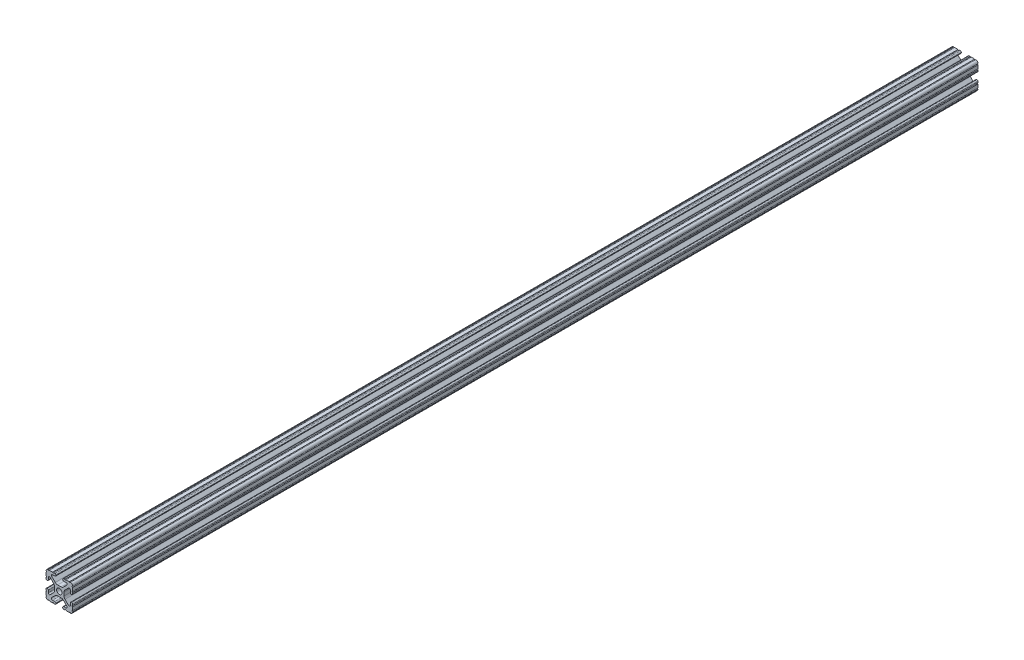
from build123d import *

# Parameters (mm, degrees)
SKETCH1_R           = 2.6035
BOSS_EXTRUDE1_DEPTH = 431.8


with BuildPart() as part:
    # Sketch1 → Boss-Extrude1 (new, symmetric)
    with BuildSketch(Plane.XY):
        with BuildLine():
            Line((-7.179650497, -8.645192506), (-3.952270251, -5.423690499))
            ThreePointArc((-3.952270251, -5.423690499), (-2.922936451, -4.736929036), (-1.709253557, -4.4958))
            Line((-1.709253557, -4.4958), (1.709253557, -4.4958))
            ThreePointArc((1.709253557, -4.4958), (2.922936451, -4.736929036), (3.952270251, -5.423690499))
            Line((3.952270251, -5.423690499), (7.179650497, -8.645192506))
            ThreePointArc((7.179650497, -8.645192506), (7.41473083, -9.822813117), (6.416408329, -10.4902))
            Line((6.416408329, -10.4902), (4.287512407, -10.4902))
            ThreePointArc((4.287512407, -10.4902), (3.54574862, -10.79744862), (3.2385, -11.539212407))
            Line((3.2385, -11.539212407), (3.2385, -11.650987593))
            ThreePointArc((3.2385, -11.650987593), (3.54574862, -12.39275138), (4.287512407, -12.7))
            Line((4.287512407, -12.7), (5.317126718, -12.7))
            ThreePointArc((5.317126718, -12.7), (5.825126718, -12.192), (6.333126718, -12.7))
            Line((6.333126718, -12.7), (9.550443118, -12.7))
            ThreePointArc((9.550443118, -12.7), (10.058366869, -12.192000006), (10.566443095, -12.699847501))
            ThreePointArc((10.566443095, -12.699847501), (12.082537762, -12.08250727), (12.699846982, -10.566399977))
            ThreePointArc((12.699846982, -10.566399977), (12.192000006, -10.058323491), (12.7, -9.5504))
            Line((12.7, -9.5504), (12.7, -6.3330836))
            ThreePointArc((12.7, -6.3330836), (12.192, -5.8250836), (12.7, -5.3170836))
            Line((12.7, -5.3170836), (12.7, -4.287469289))
            ThreePointArc((12.7, -4.287469289), (12.39275138, -3.545705502), (11.650987593, -3.238456882))
            Line((11.650987593, -3.238456882), (11.539212407, -3.238456882))
            ThreePointArc((11.539212407, -3.238456882), (10.79744862, -3.545705502), (10.4902, -4.287469289))
            Line((10.4902, -4.287469289), (10.4902, -6.402089023))
            ThreePointArc((10.4902, -6.402089023), (9.856505071, -7.351067942), (8.737131347, -7.129408934))
            Line((8.737131347, -7.129408934), (5.441005833, -3.840816462))
            ThreePointArc((5.441005833, -3.840816462), (4.750877967, -2.809883091), (4.5085, -1.593185507))
            Line((4.5085, -1.593185507), (4.5085, 1.593185507))
            ThreePointArc((4.5085, 1.593185507), (4.750877967, 2.809883091), (5.441005833, 3.840816462))
            Line((5.441005833, 3.840816462), (8.737131347, 7.129408934))
            ThreePointArc((8.737131347, 7.129408934), (9.856505071, 7.351067942), (10.4902, 6.402089023))
            Line((10.4902, 6.402089023), (10.4902, 4.287469289))
            ThreePointArc((10.4902, 4.287469289), (10.79744862, 3.545705502), (11.539212407, 3.238456882))
            Line((11.539212407, 3.238456882), (11.650987593, 3.238456882))
            ThreePointArc((11.650987593, 3.238456882), (12.39275138, 3.545705502), (12.7, 4.287469289))
            Line((12.7, 4.287469289), (12.7, 5.3170836))
            ThreePointArc((12.7, 5.3170836), (12.192, 5.8250836), (12.7, 6.3330836))
            Line((12.7, 6.3330836), (12.7, 9.5504))
            ThreePointArc((12.7, 9.5504), (12.192000006, 10.058323491), (12.699846982, 10.566399977))
            ThreePointArc((12.699846982, 10.566399977), (12.082537762, 12.08250727), (10.566443095, 12.699847501))
            ThreePointArc((10.566443095, 12.699847501), (10.058366869, 12.192000006), (9.550443118, 12.7))
            Line((9.550443118, 12.7), (6.333126718, 12.7))
            ThreePointArc((6.333126718, 12.7), (5.825126718, 12.192), (5.317126718, 12.7))
            Line((5.317126718, 12.7), (4.287512407, 12.7))
            ThreePointArc((4.287512407, 12.7), (3.54574862, 12.39275138), (3.2385, 11.650987593))
            Line((3.2385, 11.650987593), (3.2385, 11.539212407))
            ThreePointArc((3.2385, 11.539212407), (3.54574862, 10.79744862), (4.287512407, 10.4902))
            Line((4.287512407, 10.4902), (6.476788598, 10.4902))
            ThreePointArc((6.476788598, 10.4902), (7.432222385, 9.85140422), (7.207036008, 8.724370562))
            Line((7.207036008, 8.724370562), (3.898272566, 5.423169045))
            ThreePointArc((3.898272566, 5.423169045), (2.869120213, 4.736787962), (1.655778399, 4.4958))
            Line((1.655778399, 4.4958), (-1.655778399, 4.4958))
            ThreePointArc((-1.655778399, 4.4958), (-2.869120213, 4.736787962), (-3.898272566, 5.423169045))
            Line((-3.898272566, 5.423169045), (-7.207036008, 8.724370562))
            ThreePointArc((-7.207036008, 8.724370562), (-7.432222385, 9.85140422), (-6.476788598, 10.4902))
            Line((-6.476788598, 10.4902), (-4.287512407, 10.4902))
            ThreePointArc((-4.287512407, 10.4902), (-3.54574862, 10.79744862), (-3.2385, 11.539212407))
            Line((-3.2385, 11.539212407), (-3.2385, 11.650987593))
            ThreePointArc((-3.2385, 11.650987593), (-3.54574862, 12.39275138), (-4.287512407, 12.7))
            Line((-4.287512407, 12.7), (-5.317126718, 12.7))
            ThreePointArc((-5.317126718, 12.7), (-5.825126718, 12.192), (-6.333126718, 12.7))
            Line((-6.333126718, 12.7), (-9.550443118, 12.7))
            ThreePointArc((-9.550443118, 12.7), (-10.058366869, 12.192000006), (-10.566443095, 12.699847501))
            ThreePointArc((-10.566443095, 12.699847501), (-12.082537762, 12.08250727), (-12.699846982, 10.566399977))
            ThreePointArc((-12.699846982, 10.566399977), (-12.192000006, 10.058323491), (-12.7, 9.5504))
            Line((-12.7, 9.5504), (-12.7, 6.3330836))
            ThreePointArc((-12.7, 6.3330836), (-12.192, 5.8250836), (-12.7, 5.3170836))
            Line((-12.7, 5.3170836), (-12.7, 4.287469289))
            ThreePointArc((-12.7, 4.287469289), (-12.39275138, 3.545705502), (-11.650987593, 3.238456882))
            Line((-11.650987593, 3.238456882), (-11.539212407, 3.238456882))
            ThreePointArc((-11.539212407, 3.238456882), (-10.79744862, 3.545705502), (-10.4902, 4.287469289))
            Line((-10.4902, 4.287469289), (-10.4902, 6.402089023))
            ThreePointArc((-10.4902, 6.402089023), (-9.856505071, 7.351067942), (-8.737131347, 7.129408934))
            Line((-8.737131347, 7.129408934), (-5.441005833, 3.840816462))
            ThreePointArc((-5.441005833, 3.840816462), (-4.750877967, 2.809883091), (-4.5085, 1.593185507))
            Line((-4.5085, 1.593185507), (-4.5085, -1.593185507))
            ThreePointArc((-4.5085, -1.593185507), (-4.750877967, -2.809883091), (-5.441005833, -3.840816462))
            Line((-5.441005833, -3.840816462), (-8.737131347, -7.129408934))
            ThreePointArc((-8.737131347, -7.129408934), (-9.856505071, -7.351067942), (-10.4902, -6.402089023))
            Line((-10.4902, -6.402089023), (-10.4902, -4.287469289))
            ThreePointArc((-10.4902, -4.287469289), (-10.79744862, -3.545705502), (-11.539212407, -3.238456882))
            Line((-11.539212407, -3.238456882), (-11.650987593, -3.238456882))
            ThreePointArc((-11.650987593, -3.238456882), (-12.39275138, -3.545705502), (-12.7, -4.287469289))
            Line((-12.7, -4.287469289), (-12.7, -5.3170836))
            ThreePointArc((-12.7, -5.3170836), (-12.192, -5.8250836), (-12.7, -6.3330836))
            Line((-12.7, -6.3330836), (-12.7, -9.5504))
            ThreePointArc((-12.7, -9.5504), (-12.192000006, -10.058323491), (-12.699846982, -10.566399977))
            ThreePointArc((-12.699846982, -10.566399977), (-12.082537762, -12.08250727), (-10.566443095, -12.699847501))
            ThreePointArc((-10.566443095, -12.699847501), (-10.058366869, -12.192000006), (-9.550443118, -12.7))
            Line((-9.550443118, -12.7), (-6.333126718, -12.7))
            ThreePointArc((-6.333126718, -12.7), (-5.825126718, -12.192), (-5.317126718, -12.7))
            Line((-5.317126718, -12.7), (-4.287512407, -12.7))
            ThreePointArc((-4.287512407, -12.7), (-3.54574862, -12.39275138), (-3.2385, -11.650987593))
            Line((-3.2385, -11.650987593), (-3.2385, -11.539212407))
            ThreePointArc((-3.2385, -11.539212407), (-3.54574862, -10.79744862), (-4.287512407, -10.4902))
            Line((-4.287512407, -10.4902), (-6.416408329, -10.4902))
            ThreePointArc((-6.416408329, -10.4902), (-7.41473083, -9.822813117), (-7.179650497, -8.645192506))
        make_face()
        Circle(SKETCH1_R, mode=Mode.SUBTRACT)
    extrude(amount=BOSS_EXTRUDE1_DEPTH, both=True)


solid = part.part
